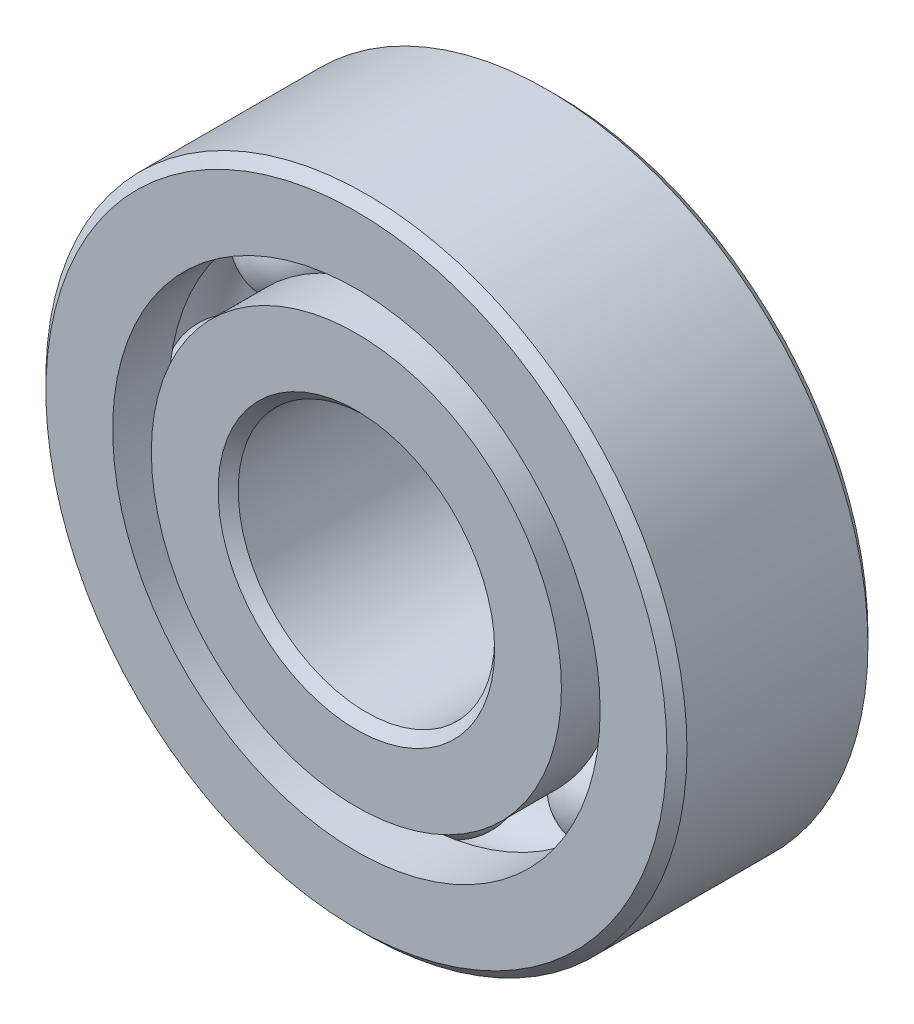
from build123d import *

# Parameters (mm, degrees)
CIRPATTERN1_COUNT = 8


with BuildPart() as part:
    # Sketch1 → Revolve1 (revolve)
    with BuildSketch(Plane(origin=(0, 0, 0), x_dir=(0, 0, -1), z_dir=(1, 0, 0))):
        with BuildLine():
            Line((2.24028, 7.9375), (-2.24028, 7.9375))
            Line((-2.24028, 7.9375), (-2.4892, 7.68858))
            Line((-2.4892, 7.68858), (-2.4892, 6.035221429))
            Line((-2.4892, 6.035221429), (-1.106311111, 6.035221429))
            ThreePointArc((-1.106311111, 6.035221429), (0, 6.76179465), (1.106311111, 6.035221429))
            Line((1.106311111, 6.035221429), (2.4892, 6.035221429))
            Line((2.4892, 6.035221429), (2.4892, 7.68858))
            Line((2.4892, 7.68858), (2.24028, 7.9375))
        make_face()
    revolve(axis=Axis((0, 0, 2.4892), (0, 0, -1)))


with BuildPart() as body_2:
    # Sketch3 → Revolve3 (revolve)
    with BuildSketch(Plane(origin=(0, 0, 0), x_dir=(0, 0, -1), z_dir=(1, 0, 0))):
        with BuildLine():
            Line((-2.4892, 5.077278571), (-1.106311111, 5.077278571))
            ThreePointArc((-1.106311111, 5.077278571), (0, 4.35070535), (1.106311111, 5.077278571))
            Line((1.106311111, 5.077278571), (2.4892, 5.077278571))
            Line((2.4892, 5.077278571), (2.4892, 3.42392))
            Line((2.4892, 3.42392), (2.24028, 3.175))
            Line((2.24028, 3.175), (-2.24028, 3.175))
            Line((-2.24028, 3.175), (-2.4892, 3.42392))
            Line((-2.4892, 3.42392), (-2.4892, 5.077278571))
        make_face()
    revolve(axis=Axis((0, 0, 2.4892), (0, 0, -1)))


with BuildPart() as body_3:
    # Sketch4 → Revolve4 (revolve)
    with BuildSketch(Plane(origin=(0, 0, 0), x_dir=(0, 0, -1), z_dir=(1, 0, 0))):
        with BuildLine():
            Line((-1.20554465, 5.55625), (1.20554465, 5.55625))
            ThreePointArc((1.20554465, 5.55625), (0, 6.76179465), (-1.20554465, 5.55625))
        make_face()
    revolve(axis=Axis((0, 5.55625, 1.20554465), (0, 0, -1)))


with BuildPart() as cirpattern1_1:
    # CirPattern1: pattern copy
    add(body_3.part.rotate(Axis((0, 0, -2.4892), (0, 0, 1)), 1 * 360 / CIRPATTERN1_COUNT))


with BuildPart() as cirpattern1_2:
    # CirPattern1: pattern copy
    add(body_3.part.rotate(Axis((0, 0, -2.4892), (0, 0, 1)), 2 * 360 / CIRPATTERN1_COUNT))


with BuildPart() as cirpattern1_3:
    # CirPattern1: pattern copy
    add(body_3.part.rotate(Axis((0, 0, -2.4892), (0, 0, 1)), 3 * 360 / CIRPATTERN1_COUNT))


with BuildPart() as cirpattern1_4:
    # CirPattern1: pattern copy
    add(body_3.part.rotate(Axis((0, 0, -2.4892), (0, 0, 1)), 4 * 360 / CIRPATTERN1_COUNT))


with BuildPart() as cirpattern1_5:
    # CirPattern1: pattern copy
    add(body_3.part.rotate(Axis((0, 0, -2.4892), (0, 0, 1)), 5 * 360 / CIRPATTERN1_COUNT))


with BuildPart() as cirpattern1_6:
    # CirPattern1: pattern copy
    add(body_3.part.rotate(Axis((0, 0, -2.4892), (0, 0, 1)), 6 * 360 / CIRPATTERN1_COUNT))


with BuildPart() as cirpattern1_7:
    # CirPattern1: pattern copy
    add(body_3.part.rotate(Axis((0, 0, -2.4892), (0, 0, 1)), 7 * 360 / CIRPATTERN1_COUNT))


solid = Compound([part.part, body_2.part, body_3.part, cirpattern1_1.part, cirpattern1_2.part, cirpattern1_3.part, cirpattern1_4.part, cirpattern1_5.part, cirpattern1_6.part, cirpattern1_7.part])
